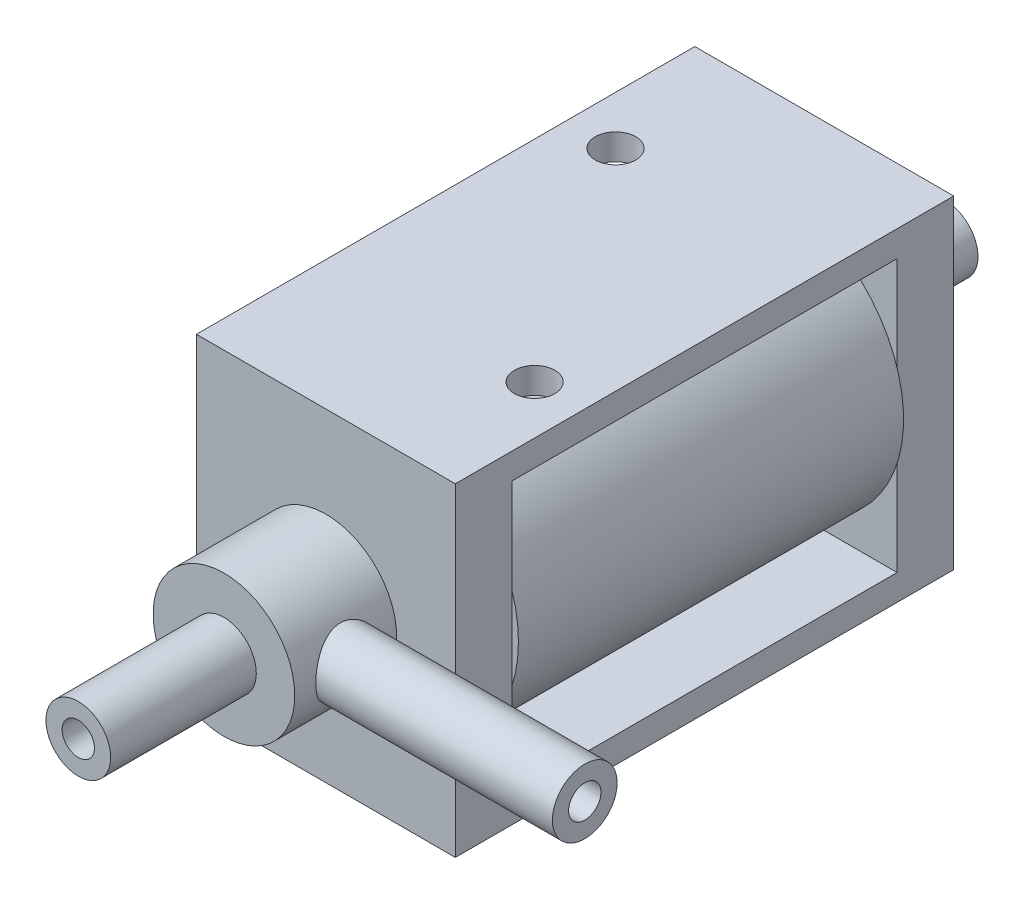
from build123d import *
from build123d.topology import SkipClean

# Parameters (mm, degrees)
FRAME_EXTRUDE_DEPTH                     = 8
FRAME_EXTRUDE_DEPTH_BACK                = 8
FRAME_SKETCH_W                          = 30.8
FRAME_SKETCH_H                          = 20
FRAME_SKETCH_W_2                        = 23.8
FRAME_SKETCH_H_2                        = 16.8
ELECTROMAGNET_EXTRUDE_REACH             = 22.029
ELECTROMAGNET_SKETCH_R                  = 8.4
ELECTROMAGNET_EXTRUDE_DIRECTION_2_REACH = 22.029
PORT_3_SKETCH_R                         = 2
PORT_3_SKETCH_R_2                       = 1
PORT_3_EXTRUDE_DEPTH                    = 7.5
PORT_3_SKETCH_3_R                       = 1
CENTER_HOLE_CUT_DEPTH                   = 34.45444664
BASE_OF_PORTS_1_2_SKETCH_R              = 4.375
BASE_OF_PORT_1_2_PORTS_DEPTH            = 6.3
PORT_2_SKETCH_R                         = 2
PORT_2_SKETCH_R_2                       = 1
PORT_2_EXTRUDE_DEPTH                    = 9
PORTS_1_SKETCH_R                        = 2
PORTS_1_SKETCH_R_2                      = 1
PORTS_1_EXTRUDE_DEPTH                   = 19
MOUNTING_HOLES_PROFILE_SKETCH_W         = 1.25
MOUNTING_HOLES_PROFILE_SKETCH_H         = 3.250185188
MOUNTING_HOLES_AT_2_COUNT               = 2
MOUNTING_HOLES_AT_2_PITCH               = 18.027756377


with BuildPart() as part:
    # Frame Sketch → Frame Extrude (new, two sides: drawn at the far end of the back side and taken through both)
    with BuildSketch(Plane(origin=(0, 0, 0), x_dir=(0, 0, -1), z_dir=(1, 0, 0)).offset(-FRAME_EXTRUDE_DEPTH_BACK)):
        Rectangle(FRAME_SKETCH_W, FRAME_SKETCH_H)
        Rectangle(FRAME_SKETCH_W_2, FRAME_SKETCH_H_2, mode=Mode.SUBTRACT)
    extrude(amount=FRAME_EXTRUDE_DEPTH + FRAME_EXTRUDE_DEPTH_BACK)


with BuildPart() as body_2:

    # Electromagnet Extrude: up to this face of the body (flat: up to its plane)
    electromagnet_extrude_end = Plane(part.part.faces().sort_by_distance((0, 0, 11.9))[0])
    # Electromagnet Sketch → Electromagnet Extrude (new, up to the picked face)
    with BuildSketch(Plane.XY, mode=Mode.PRIVATE) as electromagnet_extrude_sk1:
        with Locations(Location((0, 0, 0), (0, 0, 90))):
            Circle(ELECTROMAGNET_SKETCH_R)
    electromagnet_extrude_tool1 = split(extrude(electromagnet_extrude_sk1.sketch, amount=ELECTROMAGNET_EXTRUDE_REACH, mode=Mode.PRIVATE), bisect_by=electromagnet_extrude_end, keep=Keep.BOTH, mode=Mode.PRIVATE)
    add(electromagnet_extrude_tool1.solids().sort_by(Axis((0, 0, 0), (0, 0, 1)))[0])


    # Electromagnet Extrude direction 2: up to this face of the body (flat: up to its plane)
    electromagnet_extrude_direction_2_end = Plane(part.part.faces().sort_by_distance((0, 0, -11.9))[0])
    # Electromagnet Sketch → Electromagnet Extrude direction 2 (add, up to the picked face)
    with BuildSketch(Plane.XY, mode=Mode.PRIVATE) as electromagnet_extrude_direction_2_sk1:
        with Locations(Location((0, 0, 0), (0, 0, 90))):
            Circle(ELECTROMAGNET_SKETCH_R)
    electromagnet_extrude_direction_2_tool1 = split(extrude(electromagnet_extrude_direction_2_sk1.sketch, amount=-ELECTROMAGNET_EXTRUDE_DIRECTION_2_REACH, mode=Mode.PRIVATE), bisect_by=electromagnet_extrude_direction_2_end, keep=Keep.BOTH, mode=Mode.PRIVATE)
    add(electromagnet_extrude_direction_2_tool1.solids().sort_by(Axis((0, 0, 0), (0, 0, -1)))[0])


with BuildPart() as part_1:
    add(part.part)

    # Port 3 Sketch → Port 3 Extrude (add)
    with BuildSketch(Plane.XY.offset(-15.4)):
        Circle(PORT_3_SKETCH_R)
        Circle(PORT_3_SKETCH_R_2, mode=Mode.SUBTRACT)
    extrude(amount=-PORT_3_EXTRUDE_DEPTH)


with BuildPart() as center_hole_cut_tool:
    # Port 3 Sketch<3> → Center Hole Cut (new, through all)
    with SkipClean():  # the faces are left unmerged after this step: merging them gives an invalid solid
        with BuildSketch(Plane.XY.offset(-15.4)):
            with Locations(Location((0, 0, 0), (0, 0, 180))):
                Circle(PORT_3_SKETCH_3_R)
        extrude(amount=CENTER_HOLE_CUT_DEPTH)


with BuildPart() as part_2:
    with SkipClean():  # the faces are left unmerged after this step: merging them gives an invalid solid
        add(part_1.part)

        # Center Hole Cut: cut by center_hole_cut_tool
        add(center_hole_cut_tool.part, mode=Mode.SUBTRACT)

    # Mounting Holes Profile Sketch → Mounting Holes (revolve, cut)
    with SkipClean():  # the faces are left unmerged after this step: merging them gives an invalid solid
        with BuildSketch(Plane(origin=(5, 10, 7.5), x_dir=(0, 0, 1), z_dir=(1, 0, 0))):
            with Locations((0.625, 1.625092594)):
                Rectangle(MOUNTING_HOLES_PROFILE_SKETCH_W, MOUNTING_HOLES_PROFILE_SKETCH_H)
        mounting_holes = revolve(axis=Axis((5, 16.35, 7.5), (0, -1, 0)), mode=Mode.SUBTRACT)

    # Mounting Holes at 2: Mounting Holes ×2
    with SkipClean():  # the faces are left unmerged after this step: merging them gives an invalid solid
        with Locations(*[Vector(-0.5547001962252294, 0, -0.8320502943378435) * (i * MOUNTING_HOLES_AT_2_PITCH) for i in range(1, MOUNTING_HOLES_AT_2_COUNT)]):
            add(mounting_holes, mode=Mode.SUBTRACT)


with BuildPart() as body_2_1:
    with SkipClean():  # the faces are left unmerged after this step: merging them gives an invalid solid
        add(body_2.part)

        # Center Hole Cut: cut by center_hole_cut_tool
        add(center_hole_cut_tool.part, mode=Mode.SUBTRACT)


with BuildPart() as body_3:
    # Base of Ports 1&2 Sketch → Base of Port 1&2 Ports (new body)
    with BuildSketch(Plane.XY.offset(15.4)):
        Circle(BASE_OF_PORTS_1_2_SKETCH_R)
    extrude(amount=BASE_OF_PORT_1_2_PORTS_DEPTH)

    # Port 2 Sketch → Port 2 Extrude (add)
    with BuildSketch(Plane.XY.offset(21.7)):
        Circle(PORT_2_SKETCH_R)
        Circle(PORT_2_SKETCH_R_2, mode=Mode.SUBTRACT)
    extrude(amount=PORT_2_EXTRUDE_DEPTH)

    # Ports 1 Sketch → Ports 1 Extrude (add)
    with BuildSketch(Plane(origin=(0, 2.609545443, 0), x_dir=(0, 0, -1), z_dir=(-1, 0, 0))):
        with Locations(Location((-18.4, 2.609545443, 0), (0, 0, 180))):
            Circle(PORTS_1_SKETCH_R)
        with Locations(Location((-18.4, 2.609545443, 0), (0, 0, 180))):
            Circle(PORTS_1_SKETCH_R_2, mode=Mode.SUBTRACT)
    extrude(amount=-PORTS_1_EXTRUDE_DEPTH)


solid = Compound([part_2.part, body_2_1.part, body_3.part])
